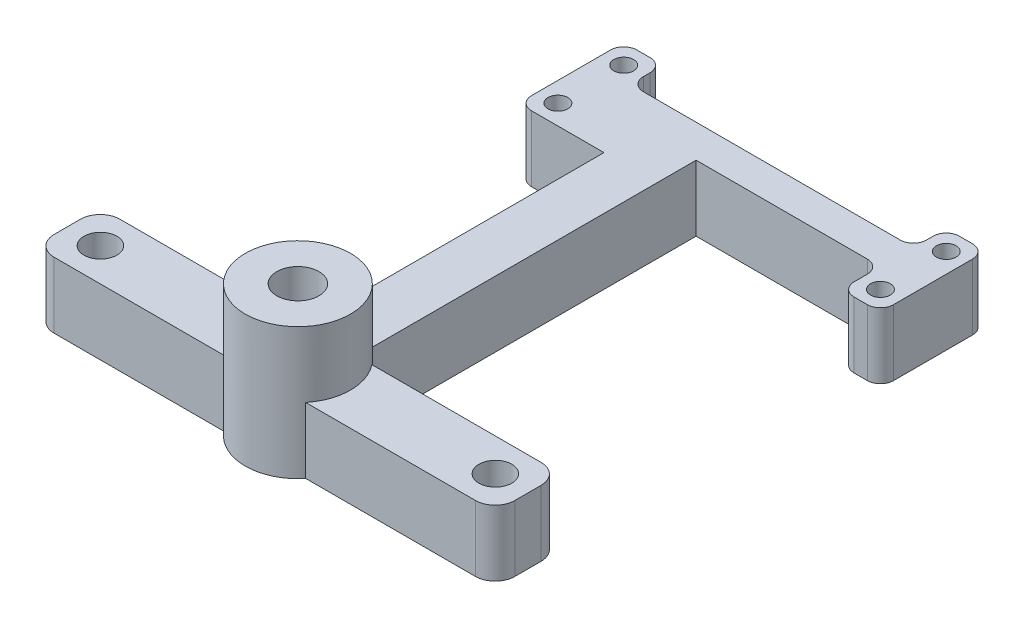
from build123d import *

# Parameters (mm, degrees)
SKETCH_2_W           = 8
SKETCH_2_H           = 17
EXTRUDE_1_DEPTH      = 10
SKETCH_4_R           = 3.2
SKETCH_4_R_2         = 2.5
EXTRUDE_2_DEPTH      = 10
SKETCH_6_R           = 1.5
EXTRUDE_3_DEPTH      = 10
FILLET_6_R           = 2
FILLET_7_R           = 3
EXTRUDE_4_DEPTH      = 10
EXTRUDE_4_DEPTH_BACK = 10
SKETCH_7_R           = 8
SKETCH_7_R_2         = 3.2


with BuildPart() as part:
    # 草图2 → 凸台-拉伸1 (new body)
    with BuildSketch(Plane(origin=(0, 0, 0), x_dir=(1, 0, 0), z_dir=(0, 1, 0))):
        with Locations((0, -14.5)):
            Rectangle(SKETCH_2_W, SKETCH_2_H)
    extrude(amount=EXTRUDE_1_DEPTH)

    # 草图4 → 凸台-拉伸2 (add)
    with BuildSketch(Plane(origin=(0, 10, 0), x_dir=(1, 0, 0), z_dir=(0, 1, 0))):
        Polygon((-4, -23), (4, -23), (4, -61.531911565), (35, -61.531911565), (35, -71.531911565), (-35, -71.531911565), (-35, -61.531911565), (-4, -61.531911565), align=None)
        with Locations((0, -66.5)):
            Circle(SKETCH_4_R, mode=Mode.SUBTRACT)
        with Locations((30, -66.5)):
            Circle(SKETCH_4_R_2, mode=Mode.SUBTRACT)
        with Locations((-30, -66.5)):
            Circle(SKETCH_4_R_2, mode=Mode.SUBTRACT)
    extrude(amount=-EXTRUDE_2_DEPTH)

    # 草图6 → 凸台-拉伸3 (add)
    with BuildSketch(Plane(origin=(0, 10, 0), x_dir=(1, 0, 0), z_dir=(0, 1, 0))):
        Polygon((-17, 0), (-17, -16), (-4, -16), (-4, -10), (32, -10), (32, -16), (38, -16), (38, 0), (32, 0), (32, -5), (-11, -5), (-11, 0), align=None)
        with Locations((-14, -3)):
            Circle(SKETCH_6_R, mode=Mode.SUBTRACT)
        with Locations((-14, -13)):
            Circle(SKETCH_6_R, mode=Mode.SUBTRACT)
        with Locations((35, -3)):
            Circle(SKETCH_6_R, mode=Mode.SUBTRACT)
        with Locations((35, -13)):
            Circle(SKETCH_6_R, mode=Mode.SUBTRACT)
    extrude(amount=-EXTRUDE_3_DEPTH)

    # 圆角6
    fillet_6_edges = [part.edges().sort_by_distance(p)[0] for p in [
        (-11, 5, 5),
        (32, 5, 5),
        (32, 5, 0),
        (38, 5, 0),
        (38, 5, 16),
        (32, 5, 16),
        (32, 5, 10),
        (-11, 5, 0),
        (-17, 5, 16),
        (-17, 5, 0),
    ]]
    fillet(fillet_6_edges, radius=FILLET_6_R)

    # 圆角7
    fillet_7_edges = [part.edges().sort_by_distance(p)[0] for p in [
        (35, 5, 71.531911565),
        (35, 5, 61.531911565),
        (-35, 5, 71.531911565),
        (-35, 5, 61.531911565),
    ]]
    fillet(fillet_7_edges, radius=FILLET_7_R)

    # 草图7 → 凸台-拉伸4 (add, two sides: drawn at the far end of the back side and taken through both)
    with BuildSketch(Plane(origin=(0, 10, 0), x_dir=(1, 0, 0), z_dir=(0, 1, 0)).offset(-EXTRUDE_4_DEPTH_BACK)):
        with Locations((0, -66.5)):
            Circle(SKETCH_7_R)
        with Locations((0, -66.5)):
            Circle(SKETCH_7_R_2, mode=Mode.SUBTRACT)
    extrude(amount=EXTRUDE_4_DEPTH + EXTRUDE_4_DEPTH_BACK)


solid = part.part
